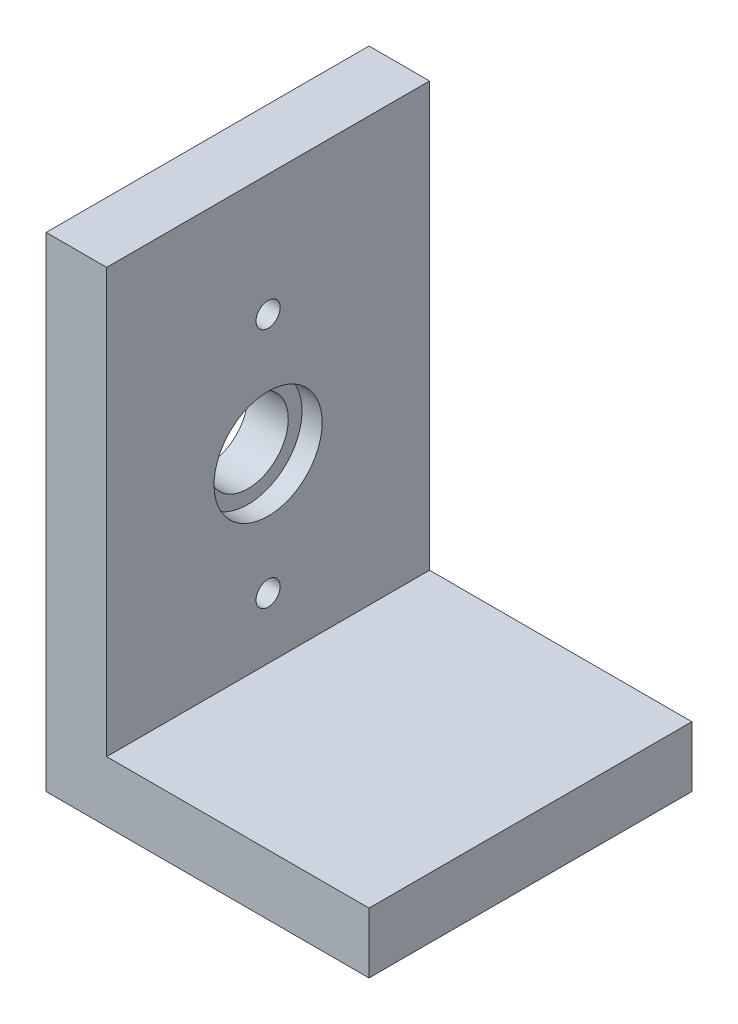
from build123d import *

# Parameters (mm, degrees)
BOSS_EXTRUDE1_DEPTH     = 25.4
SKETCH5_R               = 8.509
CUT_EXTRUDE1_DEPTH      = 3.175
CUT_EXTRUDE2_DEPTH      = 91.306287849
CUT_EXTRUDE2_DEPTH_BACK = 91.306287849
SKETCH6_R               = 6.35
F_10_24_TAPPED_HOLE1_D  = 3.7973


with BuildPart() as part:
    # Sketch2 → Boss-Extrude1 (new, symmetric)
    with BuildSketch(Plane.XY):
        Polygon((0, 0), (0, 76.2), (9.525, 76.2), (9.525, 9.525), (50.8, 9.525), (50.8, 0), align=None)
    extrude(amount=BOSS_EXTRUDE1_DEPTH, both=True)

    # Sketch5 → Cut-Extrude1 (cut)
    with BuildSketch(Plane(origin=(9.525, 0, 0), x_dir=(0, 0, -1), z_dir=(1, 0, 0))):
        with Locations(Location((0, 38.1, 0), (0, 0, 90))):
            Circle(SKETCH5_R)
    extrude(amount=-CUT_EXTRUDE1_DEPTH, mode=Mode.SUBTRACT)

    # Sketch6 → Cut-Extrude2 (cut, two sides: drawn at the far end of the back side and taken through both)
    with BuildSketch(Plane(origin=(9.525, 0, 0), x_dir=(0, 0, -1), z_dir=(1, 0, 0)).offset(-CUT_EXTRUDE2_DEPTH_BACK)):
        with Locations(Location((0, 38.1, 0), (0, 0, 90))):
            Circle(SKETCH6_R)
    extrude(amount=CUT_EXTRUDE2_DEPTH + CUT_EXTRUDE2_DEPTH_BACK, mode=Mode.SUBTRACT)

    # #10-24 Tapped Hole1 (through all)
    with Locations(Plane(origin=(9.525, 0, 0), x_dir=(0, 0, -1), z_dir=(1, 0, 0))):
        with Locations((0, 57.0992), (0, 19.1008)):
            Hole(F_10_24_TAPPED_HOLE1_D / 2)


solid = part.part
